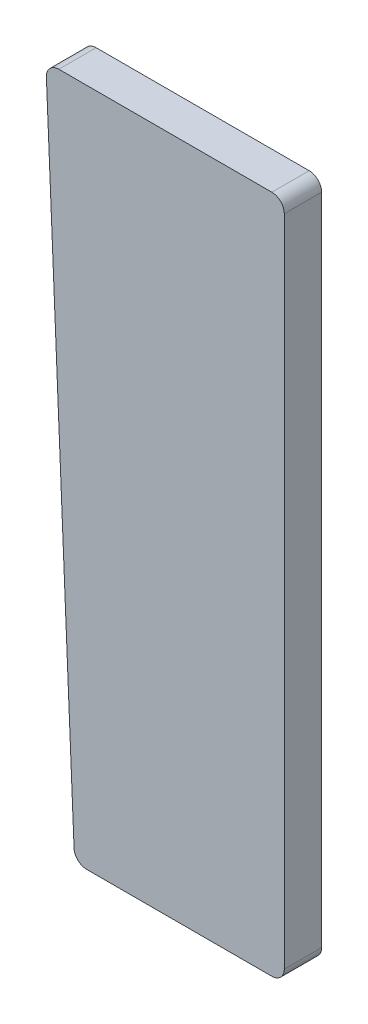
from build123d import *

# Parameters (mm, degrees)
BOSS_EXTRUDE1_DEPTH = 30
FILLET1_R           = 10
FILLET2_R           = 10


with BuildPart() as part:
    # Sketch1 → Boss-Extrude1 (new body)
    with BuildSketch(Plane.XY):
        Polygon((0, 0), (0, 299.049703647), (-191.735, 299.049703647), (-168.625, -246.950296353), (0, -246.950296353), align=None)
    extrude(amount=BOSS_EXTRUDE1_DEPTH)

    # Fillet1
    fillet1_edges = [part.edges().sort_by_distance(p)[0] for p in [
        (-191.735, 299.049703647, 15),
        (0, 299.049703647, 15),
    ]]
    fillet(fillet1_edges, radius=FILLET1_R)

    # Fillet2
    fillet2_edges = [part.edges().sort_by_distance(p)[0] for p in [
        (0, -246.950296353, 15),
        (-168.625, -246.950296353, 15),
    ]]
    fillet(fillet2_edges, radius=FILLET2_R)


solid = part.part
